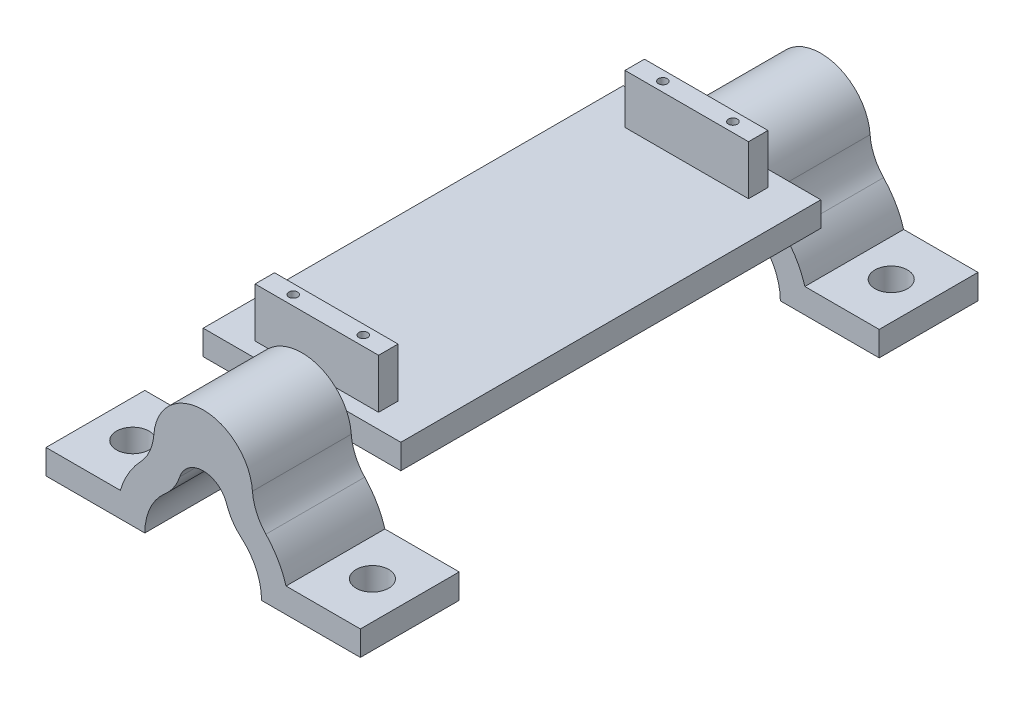
from build123d import *

# Parameters (mm, degrees)
BOSS_EXTRUDE1_DEPTH     = 25.4
SKETCH2_R               = 4.191
CUT_EXTRUDE1_DEPTH      = 6.35
SKETCH3_W               = 50.8
SKETCH3_H               = 6.35
BOSS_EXTRUDE2_DEPTH     = 107.95
SKETCH5_W               = 31.75
SKETCH5_H               = 5
BOSS_EXTRUDE3_DEPTH     = 12.7
CUT_EXTRUDE2_DEPTH      = 143.062213484
CUT_EXTRUDE2_DEPTH_BACK = 143.062213484
SKETCH4_R               = 1.15


with BuildPart() as part:
    # Sketch1 → Boss-Extrude1 (new body)
    with BuildSketch(Plane.XY):
        with BuildLine():
            Line((-40.4, 0), (-15, 0))
            ThreePointArc((-15, 0), (-13.636673939, 6.248289676), (-9.794516817, 11.360785199))
            ThreePointArc((-9.794516817, 11.360785199), (-7.529268877, 13.921260066), (-6.02906924, 16.993194444))
            ThreePointArc((-6.02906924, 16.993194444), (0, 21.35), (6.02906924, 16.993194444))
            ThreePointArc((6.02906924, 16.993194444), (7.529268877, 13.921260066), (9.794516817, 11.360785199))
            ThreePointArc((9.794516817, 11.360785199), (13.636673939, 6.248289676), (15, 0))
            Line((15, 0), (40.4, 0))
            Line((40.4, 0), (40.4, 6.35))
            Line((40.4, 6.35), (21.298547486, 6.35))
            ThreePointArc((21.298547486, 6.35), (19.237888282, 11.128983757), (16.122349869, 15.297727273))
            ThreePointArc((16.122349869, 15.297727273), (13.714805021, 18.915005141), (12.667560611, 23.132142857))
            ThreePointArc((12.667560611, 23.132142857), (0, 34.925), (-12.667560611, 23.132142857))
            ThreePointArc((-12.667560611, 23.132142857), (-13.714805021, 18.915005141), (-16.122349869, 15.297727273))
            ThreePointArc((-16.122349869, 15.297727273), (-19.237888282, 11.128983757), (-21.298547486, 6.35))
            Line((-21.298547486, 6.35), (-40.4, 6.35))
            Line((-40.4, 6.35), (-40.4, 0))
        make_face()
    boss_extrude1 = extrude(amount=BOSS_EXTRUDE1_DEPTH)

    # Sketch2 → Cut-Extrude1 (cut)
    with BuildSketch(Plane(origin=(0, 6.35, 0), x_dir=(1, 0, 0), z_dir=(0, 1, 0))):
        with Locations(Location((-30.798547486, -12.7, 0), (0, 0, 180))):
            Circle(SKETCH2_R)
        with Locations(Location((30.798553886, -12.7, 0), (0, 0, 180))):
            Circle(SKETCH2_R)
    cut_extrude1 = extrude(amount=-CUT_EXTRUDE1_DEPTH, mode=Mode.SUBTRACT)

    # Sketch3 → Boss-Extrude2 (add)
    with BuildSketch(Plane(origin=(0, 0, 0), x_dir=(-1, 0, 0), z_dir=(0, 0, -1))):
        with Locations((0, 24.525)):
            Rectangle(SKETCH3_W, SKETCH3_H)
    extrude(amount=BOSS_EXTRUDE2_DEPTH)

    # Mirror1: Boss-Extrude1, Cut-Extrude1 across plane
    add(boss_extrude1.mirror(Plane(origin=(0, 0, -53.975), x_dir=(1, 0, 0), z_dir=(0, 0, -1))))
    add(cut_extrude1.mirror(Plane(origin=(0, 0, -53.975), x_dir=(1, 0, 0), z_dir=(0, 0, -1))), mode=Mode.SUBTRACT)

    # Sketch5 → Boss-Extrude3 (add)
    with BuildSketch(Plane(origin=(0, 27.7, 0), x_dir=(1, 0, 0), z_dir=(0, 1, 0))):
        with Locations((0, 6.31)):
            Rectangle(SKETCH5_W, SKETCH5_H)
        with Locations((0, 101.3899878)):
            Rectangle(SKETCH5_W, SKETCH5_H)
    extrude(amount=BOSS_EXTRUDE3_DEPTH)

    # Sketch4 → Cut-Extrude2 (cut, two sides: drawn at the far end of the back side and taken through both)
    with BuildSketch(Plane(origin=(0, 27.7, 0), x_dir=(1, 0, 0), z_dir=(0, 1, 0)).offset(-CUT_EXTRUDE2_DEPTH_BACK)):
        with Locations(Location((9.4, 101.349999992, 0), (0, 0, 180))):
            Circle(SKETCH4_R)
        with Locations(Location((-8.6, 101.35, 0), (0, 0, 180))):
            Circle(SKETCH4_R)
        with Locations(Location((9.4, 6.35, 0), (0, 0, 180))):
            Circle(SKETCH4_R)
        with Locations(Location((-8.6, 6.35, 0), (0, 0, 180))):
            Circle(SKETCH4_R)
    extrude(amount=CUT_EXTRUDE2_DEPTH + CUT_EXTRUDE2_DEPTH_BACK, mode=Mode.SUBTRACT)


solid = part.part
